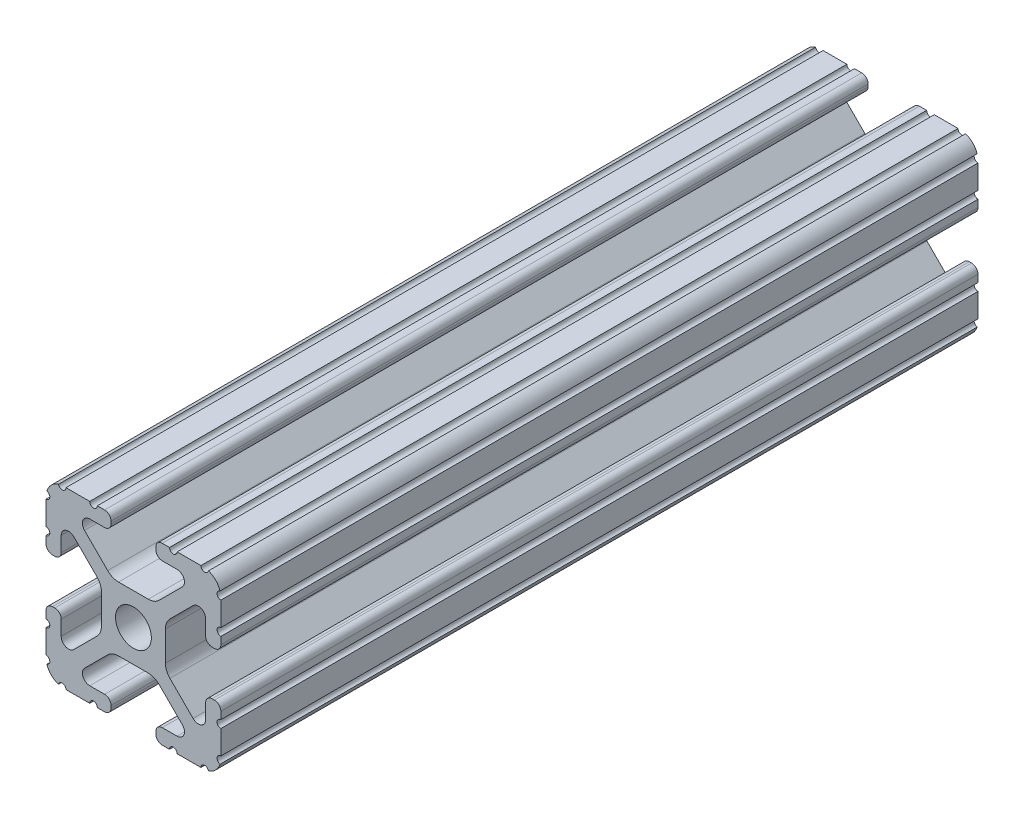
from build123d import *

# Parameters (mm, degrees)
BOSS_EXTRUDE1_DEPTH     = 76.2
CUT_EXTRUDE1_DEPTH      = 79.288057838
CUT_EXTRUDE1_DEPTH_BACK = 79.288057838
SKETCH5_R               = 0.55245
SKETCH6_R               = 2.6035
CUT_EXTRUDE3_DEPTH      = 42.418


with BuildPart() as part:
    # Sketch4 → Boss-Extrude1 (new, symmetric)
    with BuildSketch(Plane.XY):
        with BuildLine():
            Line((4.190365, -12.7), (10.11729625, -12.7))
            ThreePointArc((10.11729625, -12.7), (11.943543585, -11.943543585), (12.7, -10.11729625))
            Line((12.7, -10.11729625), (12.7, -4.190365))
            ThreePointArc((12.7, -4.190365), (12.42492494, -3.52627506), (11.760835, -3.2512))
            Line((11.760835, -3.2512), (11.429365, -3.2512))
            ThreePointArc((11.429365, -3.2512), (10.76527506, -3.52627506), (10.4902, -4.190365))
            Line((10.4902, -4.190365), (10.4902, -6.348478019))
            ThreePointArc((10.4902, -6.348478019), (9.830707141, -7.335478831), (8.666460301, -7.103895736))
            Line((8.666460301, -7.103895736), (5.299899128, -3.737334563))
            ThreePointArc((5.299899128, -3.737334563), (4.817571085, -3.015479634), (4.6482, -2.16399369))
            Line((4.6482, -2.16399369), (4.6482, 0))
            Line((4.6482, 0), (2.6035, 0))
            ThreePointArc((2.6035, 0), (1.840952505, -1.840952505), (0, -2.6035))
            Line((0, -2.6035), (0, -4.6482))
            Line((0, -4.6482), (2.16399369, -4.6482))
            ThreePointArc((2.16399369, -4.6482), (3.015479634, -4.817571085), (3.737334563, -5.299899128))
            Line((3.737334563, -5.299899128), (7.103895736, -8.666460301))
            ThreePointArc((7.103895736, -8.666460301), (7.335478831, -9.830707141), (6.348478019, -10.4902))
            Line((6.348478019, -10.4902), (4.190365, -10.4902))
            ThreePointArc((4.190365, -10.4902), (3.52627506, -10.76527506), (3.2512, -11.429365))
            Line((3.2512, -11.429365), (3.2512, -11.760835))
            ThreePointArc((3.2512, -11.760835), (3.52627506, -12.42492494), (4.190365, -12.7))
        make_face()
    extrude(amount=BOSS_EXTRUDE1_DEPTH, both=True)

    # Sketch5 → Cut-Extrude1 (cut, two sides: drawn at the far end of the back side and taken through both)
    with BuildSketch(Plane.XY.offset(-CUT_EXTRUDE1_DEPTH_BACK)):
        with Locations((10.356153152, -12.7)):
            Circle(SKETCH5_R)
        with Locations((5.796028019, -12.7)):
            Circle(SKETCH5_R)
        with Locations((12.7, -10.356153152)):
            Circle(SKETCH5_R)
        with Locations((12.7, -5.796028019)):
            Circle(SKETCH5_R)
    extrude(amount=CUT_EXTRUDE1_DEPTH + CUT_EXTRUDE1_DEPTH_BACK, mode=Mode.SUBTRACT)

    # Mirror1: part across plane


with BuildPart() as part_1:
    add(part.part)
    add(part.part.mirror(Plane(origin=(0, 0, 0), x_dir=(0, 0, 1), z_dir=(1, 0, 0))))

    # Mirror2: part across plane


with BuildPart() as part_2:
    add(part_1.part)
    add(part_1.part.mirror(Plane.ZX))

    # Sketch6 → Cut-Extrude3 (cut)
    with BuildSketch(Plane.XY.offset(76.2)):
        with BuildLine():
            Line((12.7, -5.243578019), (12.7, -4.190365))
            ThreePointArc((12.7, -4.190365), (12.42492494, -3.52627506), (11.760835, -3.2512))
            Line((11.760835, -3.2512), (11.429365, -3.2512))
            ThreePointArc((11.429365, -3.2512), (10.76527506, -3.52627506), (10.4902, -4.190365))
            Line((10.4902, -4.190365), (10.4902, -6.348478019))
            ThreePointArc((10.4902, -6.348478019), (9.830707141, -7.335478831), (8.666460301, -7.103895736))
            Line((8.666460301, -7.103895736), (5.299899128, -3.737334563))
            ThreePointArc((5.299899128, -3.737334563), (4.817571085, -3.015479634), (4.6482, -2.16399369))
            Line((4.6482, -2.16399369), (4.6482, 2.16399369))
            ThreePointArc((4.6482, 2.16399369), (4.817571085, 3.015479634), (5.299899128, 3.737334563))
            Line((5.299899128, 3.737334563), (8.666460301, 7.103895736))
            ThreePointArc((8.666460301, 7.103895736), (9.830707141, 7.335478831), (10.4902, 6.348478019))
            Line((10.4902, 6.348478019), (10.4902, 4.190365))
            ThreePointArc((10.4902, 4.190365), (10.76527506, 3.52627506), (11.429365, 3.2512))
            Line((11.429365, 3.2512), (11.760835, 3.2512))
            ThreePointArc((11.760835, 3.2512), (12.42492494, 3.52627506), (12.7, 4.190365))
            Line((12.7, 4.190365), (12.7, 5.243578019))
            ThreePointArc((12.7, 5.243578019), (12.14755, 5.796028019), (12.7, 6.348478019))
            Line((12.7, 6.348478019), (12.7, 9.803703152))
            ThreePointArc((12.7, 9.803703152), (12.150857656, 10.295790178), (12.579996867, 10.895412135))
            ThreePointArc((12.579996867, 10.895412135), (11.943543585, 11.943543585), (10.895412135, 12.579996867))
            ThreePointArc((10.895412135, 12.579996867), (10.295790178, 12.150857656), (9.803703152, 12.7))
            Line((9.803703152, 12.7), (6.348478019, 12.7))
            ThreePointArc((6.348478019, 12.7), (5.796028019, 12.14755), (5.243578019, 12.7))
            Line((5.243578019, 12.7), (4.190365, 12.7))
            ThreePointArc((4.190365, 12.7), (3.52627506, 12.42492494), (3.2512, 11.760835))
            Line((3.2512, 11.760835), (3.2512, 11.429365))
            ThreePointArc((3.2512, 11.429365), (3.52627506, 10.76527506), (4.190365, 10.4902))
            Line((4.190365, 10.4902), (6.348478019, 10.4902))
            ThreePointArc((6.348478019, 10.4902), (7.335478831, 9.830707141), (7.103895736, 8.666460301))
            Line((7.103895736, 8.666460301), (3.737334563, 5.299899128))
            ThreePointArc((3.737334563, 5.299899128), (3.015479634, 4.817571085), (2.16399369, 4.6482))
            Line((2.16399369, 4.6482), (-2.16399369, 4.6482))
            ThreePointArc((-2.16399369, 4.6482), (-3.015479634, 4.817571085), (-3.737334563, 5.299899128))
            Line((-3.737334563, 5.299899128), (-7.103895736, 8.666460301))
            ThreePointArc((-7.103895736, 8.666460301), (-7.335478831, 9.830707141), (-6.348478019, 10.4902))
            Line((-6.348478019, 10.4902), (-4.190365, 10.4902))
            ThreePointArc((-4.190365, 10.4902), (-3.52627506, 10.76527506), (-3.2512, 11.429365))
            Line((-3.2512, 11.429365), (-3.2512, 11.760835))
            ThreePointArc((-3.2512, 11.760835), (-3.52627506, 12.42492494), (-4.190365, 12.7))
            Line((-4.190365, 12.7), (-5.243578019, 12.7))
            ThreePointArc((-5.243578019, 12.7), (-5.796028019, 12.14755), (-6.348478019, 12.7))
            Line((-6.348478019, 12.7), (-9.803703152, 12.7))
            ThreePointArc((-9.803703152, 12.7), (-10.295790178, 12.150857656), (-10.895412135, 12.579996867))
            ThreePointArc((-10.895412135, 12.579996867), (-11.943543585, 11.943543585), (-12.579996867, 10.895412135))
            ThreePointArc((-12.579996867, 10.895412135), (-12.150857656, 10.295790178), (-12.7, 9.803703152))
            Line((-12.7, 9.803703152), (-12.7, 6.348478019))
            ThreePointArc((-12.7, 6.348478019), (-12.14755, 5.796028019), (-12.7, 5.243578019))
            Line((-12.7, 5.243578019), (-12.7, 4.190365))
            ThreePointArc((-12.7, 4.190365), (-12.42492494, 3.52627506), (-11.760835, 3.2512))
            Line((-11.760835, 3.2512), (-11.429365, 3.2512))
            ThreePointArc((-11.429365, 3.2512), (-10.76527506, 3.52627506), (-10.4902, 4.190365))
            Line((-10.4902, 4.190365), (-10.4902, 6.348478019))
            ThreePointArc((-10.4902, 6.348478019), (-9.830707141, 7.335478831), (-8.666460301, 7.103895736))
            Line((-8.666460301, 7.103895736), (-5.299899128, 3.737334563))
            ThreePointArc((-5.299899128, 3.737334563), (-4.817571085, 3.015479634), (-4.6482, 2.16399369))
            Line((-4.6482, 2.16399369), (-4.6482, -2.16399369))
            ThreePointArc((-4.6482, -2.16399369), (-4.817571085, -3.015479634), (-5.299899128, -3.737334563))
            Line((-5.299899128, -3.737334563), (-8.666460301, -7.103895736))
            ThreePointArc((-8.666460301, -7.103895736), (-9.830707141, -7.335478831), (-10.4902, -6.348478019))
            Line((-10.4902, -6.348478019), (-10.4902, -4.190365))
            ThreePointArc((-10.4902, -4.190365), (-10.76527506, -3.52627506), (-11.429365, -3.2512))
            Line((-11.429365, -3.2512), (-11.760835, -3.2512))
            ThreePointArc((-11.760835, -3.2512), (-12.42492494, -3.52627506), (-12.7, -4.190365))
            Line((-12.7, -4.190365), (-12.7, -5.243578019))
            ThreePointArc((-12.7, -5.243578019), (-12.14755, -5.796028019), (-12.7, -6.348478019))
            Line((-12.7, -6.348478019), (-12.7, -9.803703152))
            ThreePointArc((-12.7, -9.803703152), (-12.150857656, -10.295790178), (-12.579996867, -10.895412135))
            ThreePointArc((-12.579996867, -10.895412135), (-11.943543585, -11.943543585), (-10.895412135, -12.579996867))
            ThreePointArc((-10.895412135, -12.579996867), (-10.295790178, -12.150857656), (-9.803703152, -12.7))
            Line((-9.803703152, -12.7), (-6.348478019, -12.7))
            ThreePointArc((-6.348478019, -12.7), (-5.796028019, -12.14755), (-5.243578019, -12.7))
            Line((-5.243578019, -12.7), (-4.190365, -12.7))
            ThreePointArc((-4.190365, -12.7), (-3.52627506, -12.42492494), (-3.2512, -11.760835))
            Line((-3.2512, -11.760835), (-3.2512, -11.429365))
            ThreePointArc((-3.2512, -11.429365), (-3.52627506, -10.76527506), (-4.190365, -10.4902))
            Line((-4.190365, -10.4902), (-6.348478019, -10.4902))
            ThreePointArc((-6.348478019, -10.4902), (-7.335478831, -9.830707141), (-7.103895736, -8.666460301))
            Line((-7.103895736, -8.666460301), (-3.737334563, -5.299899128))
            ThreePointArc((-3.737334563, -5.299899128), (-3.015479634, -4.817571085), (-2.16399369, -4.6482))
            Line((-2.16399369, -4.6482), (2.16399369, -4.6482))
            ThreePointArc((2.16399369, -4.6482), (3.015479634, -4.817571085), (3.737334563, -5.299899128))
            Line((3.737334563, -5.299899128), (7.103895736, -8.666460301))
            ThreePointArc((7.103895736, -8.666460301), (7.335478831, -9.830707141), (6.348478019, -10.4902))
            Line((6.348478019, -10.4902), (4.190365, -10.4902))
            ThreePointArc((4.190365, -10.4902), (3.52627506, -10.76527506), (3.2512, -11.429365))
            Line((3.2512, -11.429365), (3.2512, -11.760835))
            ThreePointArc((3.2512, -11.760835), (3.52627506, -12.42492494), (4.190365, -12.7))
            Line((4.190365, -12.7), (5.243578019, -12.7))
            ThreePointArc((5.243578019, -12.7), (5.796028019, -12.14755), (6.348478019, -12.7))
            Line((6.348478019, -12.7), (9.803703152, -12.7))
            ThreePointArc((9.803703152, -12.7), (10.295790178, -12.150857656), (10.895412135, -12.579996867))
            ThreePointArc((10.895412135, -12.579996867), (11.943543585, -11.943543585), (12.579996867, -10.895412135))
            ThreePointArc((12.579996867, -10.895412135), (12.150857656, -10.295790178), (12.7, -9.803703152))
            Line((12.7, -9.803703152), (12.7, -6.348478019))
            ThreePointArc((12.7, -6.348478019), (12.14755, -5.796028019), (12.7, -5.243578019))
        make_face()
        with Locations(Location((0, 0, 0), (0, 0, 180))):
            Circle(SKETCH6_R, mode=Mode.SUBTRACT)
    extrude(amount=-CUT_EXTRUDE3_DEPTH, mode=Mode.SUBTRACT)


solid = part_2.part
